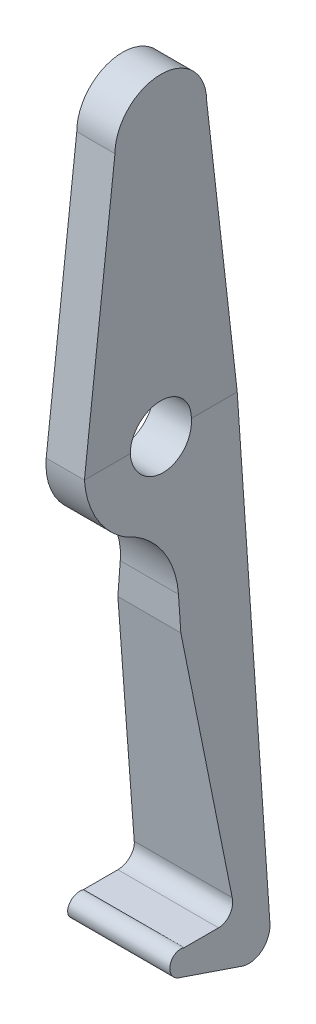
from build123d import *

# Parameters (mm, degrees)
BOSS_EXTRUDE1_DEPTH = 14
SKETCH5_OUTSIDE_W   = 36.988
SKETCH5_OUTSIDE_H   = 125.051
CUT_EXTRUDE1_DEPTH  = 100.116594104


with BuildPart() as part:
    # Sketch2 → Boss-Extrude1 (new body)
    with BuildSketch(Plane(origin=(0, 0, 0), x_dir=(0, 0, -1), z_dir=(1, 0, 0))):
        with BuildLine():
            ThreePointArc((6, 0), (0, 6), (-6, 0))
            Line((-6, 0), (-9.742143433, -32.743755036))
            ThreePointArc((-9.742143433, -32.743755036), (0, -25), (9.742143433, -32.743755036))
            Line((9.742143433, -32.743755036), (6, 0))
        make_face()
        with BuildLine():
            ThreePointArc((9.742143433, -32.743755036), (0, -25), (-9.742143433, -32.743755036))
            Line((-9.742143433, -32.743755036), (-10, -35))
            Line((-10, -35), (-4, -35))
            ThreePointArc((-4, -35), (0, -31), (4, -35))
            Line((4, -35), (10, -35))
            Line((10, -35), (9.742143433, -32.743755036))
        make_face()
        with BuildLine():
            Line((-4, -35), (-10, -35))
            ThreePointArc((-10, -35), (-8.730548592, -39.876219979), (-5.244495744, -43.514415094))
            Line((-5.244495744, -43.514415094), (10, -35))
            Line((10, -35), (4, -35))
            ThreePointArc((4, -35), (0, -39), (-4, -35))
        make_face()
        with BuildLine():
            Line((10, -57), (10, -35))
            ThreePointArc((10, -35), (5.587707823, -43.293221406), (-3.755504256, -44.268019626))
            ThreePointArc((-3.755504256, -44.268019626), (-0.269451408, -47.906214741), (1, -52.78243472))
            Line((1, -52.78243472), (1, -57))
            Line((1, -57), (5.433108836, -88.085634368))
            ThreePointArc((5.433108836, -88.085634368), (4.995673886, -89.718617368), (3.463525492, -90.433113071))
            Line((3.463525492, -90.433113071), (-1.036474508, -90.433113071))
            ThreePointArc((-1.036474508, -90.433113071), (-2.926584774, -91.396172354), (-1.963525492, -93.28628262))
            Line((-1.963525492, -93.28628262), (6.388437813, -96))
            ThreePointArc((6.388437813, -96), (8.892790723, -95.390514833), (10, -93.062996137))
            Line((10, -93.062996137), (10, -57))
        make_face()
        with BuildLine():
            Line((10, -35), (-5.244495744, -43.514415094))
            ThreePointArc((-5.244495744, -43.514415094), (-4.484252006, -43.860102062), (-3.755504256, -44.268019626))
            ThreePointArc((-3.755504256, -44.268019626), (5.587707823, -43.293221406), (10, -35))
        make_face()
    extrude(amount=BOSS_EXTRUDE1_DEPTH)

    # Sketch5 outside → Cut-Extrude1 (cut, through all)
    with BuildSketch(Plane(origin=(0, 0, -10), x_dir=(-1, 0, 0), z_dir=(0, 0, -1))):
        with Locations((-7, -45.0315)):
            Rectangle(SKETCH5_OUTSIDE_W, SKETCH5_OUTSIDE_H)
        Polygon((0, -96.062996137), (-14, -96.062996137), (-9.5, -35), (-9.5, 6), (-4.5, 6), (-4.5, -35), align=None, mode=Mode.SUBTRACT)
    extrude(amount=-CUT_EXTRUDE1_DEPTH, mode=Mode.SUBTRACT)


solid = part.part
